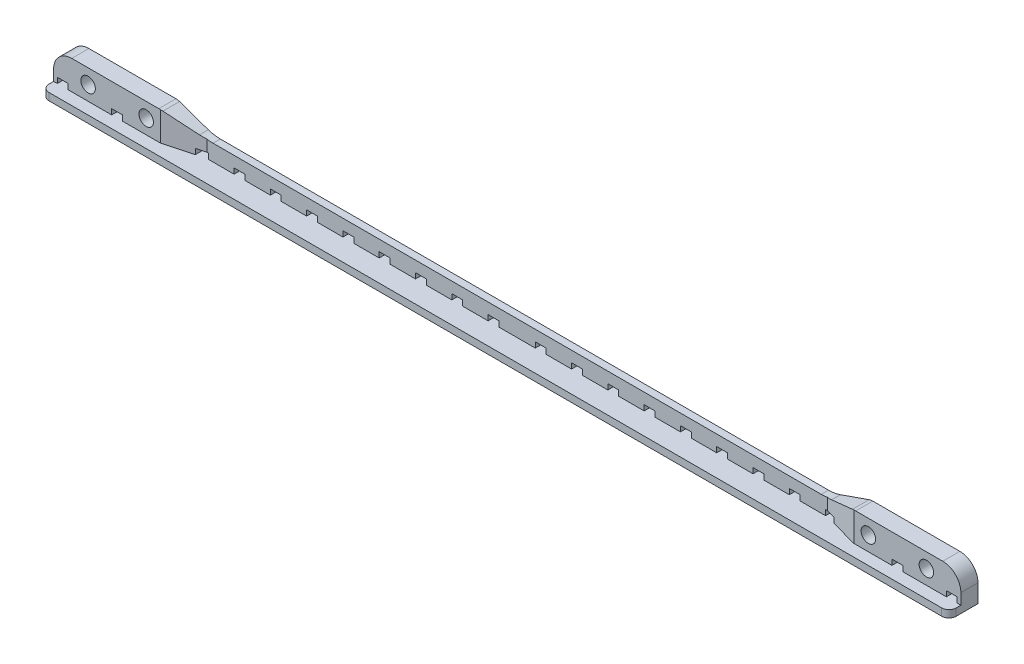
from build123d import *

# Parameters (mm, degrees)
BOSS_EXTRUDE1_DEPTH     = 125
CUT_EXTRUDE2_DEPTH      = 126.344667089
CUT_EXTRUDE3_DEPTH      = 126.54282138
CUT_EXTRUDE3_DEPTH_BACK = 126.54282138
SKETCH3_W               = 3
SKETCH3_H               = 1.5
CUT_EXTRUDE4_DEPTH      = 126.54282138
CUT_EXTRUDE4_DEPTH_BACK = 126.54282138
SKETCH5_R               = 2
CUT_EXTRUDE5_DEPTH      = 126.654287631
FILLET1_R               = 5
FILLET2_R               = 3
FILLET3_R               = 10
FILLET4_R               = 2


with BuildPart() as part:
    # Sketch1 → Boss-Extrude1 (new body)
    with BuildSketch(Plane(origin=(0, 0, 0), x_dir=(0, 0, -1), z_dir=(1, 0, 0))):
        Polygon((-3.27924078, -8), (0, -8), (0, 0), (4.72075922, 0), (4.72075922, -10), (-3.27924078, -10), align=None)
    extrude(amount=-BOSS_EXTRUDE1_DEPTH)

    # Sketch2 → Cut-Extrude2 (cut, through all)
    with BuildSketch(Plane(origin=(0, -8, 0), x_dir=(1, 0, 0), z_dir=(0, 1, 0))):
        Polygon((-95.5, 0), (-85.5, 2.72075922), (0, 2.72075922), (0, 0), align=None)
    extrude(amount=CUT_EXTRUDE2_DEPTH, mode=Mode.SUBTRACT)

    # Sketch3 → Cut-Extrude3 (cut, two sides: drawn at the far end of the back side and taken through both)
    with BuildSketch(Plane.XY.offset(-2.72075922).offset(-CUT_EXTRUDE3_DEPTH_BACK)):
        with Locations((-122.5, -7.25)):
            Rectangle(SKETCH3_W, SKETCH3_H)
        with Locations((-6.5, -7.25)):
            Rectangle(SKETCH3_W, SKETCH3_H)
        with Locations((-16.5, -7.25)):
            Rectangle(SKETCH3_W, SKETCH3_H)
        with Locations((-26.5, -7.25)):
            Rectangle(SKETCH3_W, SKETCH3_H)
        with Locations((-36.5, -7.25)):
            Rectangle(SKETCH3_W, SKETCH3_H)
        with Locations((-46.5, -7.25)):
            Rectangle(SKETCH3_W, SKETCH3_H)
        with Locations((-56.5, -7.25)):
            Rectangle(SKETCH3_W, SKETCH3_H)
        with Locations((-66.5, -7.25)):
            Rectangle(SKETCH3_W, SKETCH3_H)
        with Locations((-76.5, -7.25)):
            Rectangle(SKETCH3_W, SKETCH3_H)
        with Locations((-86.5, -7.25)):
            Rectangle(SKETCH3_W, SKETCH3_H)
        with Locations((-107.5, -7.25)):
            Rectangle(SKETCH3_W, SKETCH3_H)
    extrude(amount=CUT_EXTRUDE3_DEPTH + CUT_EXTRUDE3_DEPTH_BACK, mode=Mode.SUBTRACT)

    # Sketch4 → Cut-Extrude4 (cut, two sides: drawn at the far end of the back side and taken through both)
    with BuildSketch(Plane.XY.offset(-2.72075922).offset(-CUT_EXTRUDE4_DEPTH_BACK)):
        Polygon((260.33777182, -3.5), (0, -3.5), (-85.5, -3.5), (-95.5, 0), (-341.22198141, 86.002693494), (-264.597067166, 601.009144194), (336.962686065, 511.5064507), align=None)
    extrude(amount=CUT_EXTRUDE4_DEPTH + CUT_EXTRUDE4_DEPTH_BACK, mode=Mode.SUBTRACT)

    # Sketch5 → Cut-Extrude5 (cut, through all)
    with BuildSketch(Plane(origin=(0, 0, -4.72075922), x_dir=(-1, 0, 0), z_dir=(0, 0, -1))):
        with Locations(Location((99.5, -4, 0), (0, 0, 90))):
            Circle(SKETCH5_R)
        with Locations(Location((115.5, -4, 0), (0, 0, 90))):
            Circle(SKETCH5_R)
    extrude(amount=-CUT_EXTRUDE5_DEPTH, mode=Mode.SUBTRACT)

    # Fillet1
    fillet1_edges = [part.edges().sort_by_distance(p)[0] for p in [
        (-125, 0, -2.36037961),
    ]]
    fillet(fillet1_edges, radius=FILLET1_R)

    # Fillet2
    fillet2_edges = [part.edges().sort_by_distance(p)[0] for p in [
        (-95.5, 0, -2.36037961),
    ]]
    fillet(fillet2_edges, radius=FILLET2_R)

    # Fillet3
    fillet3_edges = [part.edges().sort_by_distance(p)[0] for p in [
        (-85.5, -3.5, -3.72075922),
    ]]
    fillet(fillet3_edges, radius=FILLET3_R)

    # Fillet4
    fillet4_edges = [part.edges().sort_by_distance(p)[0] for p in [
        (-125, -9, 3.27924078),
    ]]
    fillet(fillet4_edges, radius=FILLET4_R)

    # Mirror1: part across plane


with BuildPart() as part_1:
    add(part.part)
    add(part.part.mirror(Plane.ZY))


solid = part_1.part
